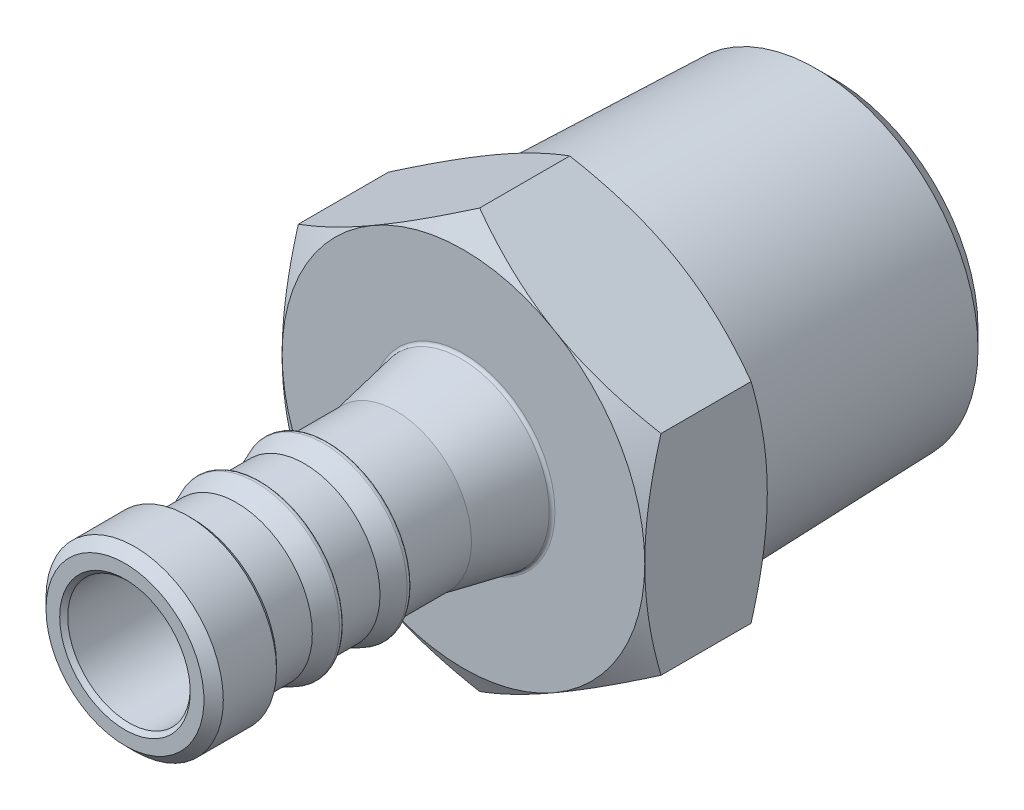
from build123d import *

# Parameters (mm, degrees)
CHAMFER1_SIZE       = 0.381
CHAMFER2_SIZE       = 0.762
SKETCH3_R           = 12.707475311
BOSS_EXTRUDE1_DEPTH = 19.558
BOSS_EXTRUDE1_DRAFT = -1.78333333
SKETCH6_OUTSIDE_W   = 81.226
SKETCH6_OUTSIDE_H   = 81.226
SKETCH6_OUTSIDE_R   = 11.332659983
CUT_EXTRUDE1_DEPTH  = 19.558
CUT_EXTRUDE1_DRAFT  = -45
BOSS_EXTRUDE2_DEPTH = 9.652
SKETCH8_OUTSIDE_W   = 78.192
SKETCH8_OUTSIDE_H   = 82.612
SKETCH8_OUTSIDE_R   = 14.2875
CUT_EXTRUDE2_DEPTH  = 9.652
CUT_EXTRUDE2_DRAFT  = -60
SKETCH9_OUTSIDE_W   = 78.192
SKETCH9_OUTSIDE_H   = 82.612
SKETCH9_OUTSIDE_R   = 14.2875
CUT_EXTRUDE3_DEPTH  = 9.652
CUT_EXTRUDE3_DRAFT  = -60
SKETCH10_W          = 36.322
SKETCH10_H          = 4.826
CHAMFER3_SIZE       = 0.3175
CHAMFER4_SIZE       = 0.508


with BuildPart() as part:
    # Sketch2 → Revolve1 (revolve)
    with BuildSketch(Plane(origin=(0, 0, 0), x_dir=(0, 0, -1), z_dir=(1, 0, 0)), mode=Mode.PRIVATE) as revolve1_sk:
        with BuildLine():
            Line((-21.082, 5.969), (-17.87705275, 5.969))
            Line((-17.87705275, 5.969), (-16.351150075, 6.585504699))
            ThreePointArc((-16.351150075, 6.585504699), (-16.113965003, 6.560575543), (-16.002, 6.35))
            Line((-16.002, 6.35), (-16.002, 6.223))
            ThreePointArc((-16.002, 6.223), (-15.927605122, 6.043394878), (-15.748, 5.969))
            Line((-15.748, 5.969), (-12.54305275, 5.969))
            Line((-12.54305275, 5.969), (-11.017150075, 6.585504699))
            ThreePointArc((-11.017150075, 6.585504699), (-10.779965003, 6.560575543), (-10.668, 6.35))
            Line((-10.668, 6.35), (-10.668, 6.223))
            ThreePointArc((-10.668, 6.223), (-10.593605122, 6.043394878), (-10.414, 5.969))
            Line((-10.414, 5.969), (-5.334, 5.969))
            Line((-5.334, 5.969), (-0.205534515, 6.965872706))
            ThreePointArc((-0.205534515, 6.965872706), (-0.058007356, 7.053642143), (0, 7.215206011))
            Line((0, 7.215206011), (0, 0))
            Line((0, 0), (-26.67, 0))
            Line((-26.67, 0), (-26.67, 6.985))
            Line((-26.67, 6.985), (-21.336, 6.985))
            Line((-21.336, 6.985), (-21.336, 6.223))
            ThreePointArc((-21.336, 6.223), (-21.261605122, 6.043394878), (-21.082, 5.969))
        make_face()
    revolve(revolve1_sk.sketch.rotate(Axis((0, 0, 26.67), (0, 0, -1)), 90), axis=Axis((0, 0, 26.67), (0, 0, -1)))

    # Chamfer1
    chamfer1_edges = [part.edges().sort_by_distance(p)[0] for p in [
        (-6.985, 0, 21.336),
    ]]
    chamfer(chamfer1_edges, length=CHAMFER1_SIZE)

    # Chamfer2
    chamfer2_edges = [part.edges().sort_by_distance(p)[0] for p in [
        (-6.985, 0, 26.67),
    ]]
    chamfer(chamfer2_edges, length=CHAMFER2_SIZE)



with BuildPart() as body_2:
    # Sketch3 → Boss-Extrude1 (with draft: the straight prism first)
    with BuildSketch(Plane.XY.offset(-29.21)):
        Circle(SKETCH3_R)
    extrude(amount=BOSS_EXTRUDE1_DEPTH)
    # Boss-Extrude1: the draft: its side faces are tilted about the plane it starts from
    boss_extrude1_sides = [body_2.faces().sort_by_distance(p)[0] for p in [
        (-12.707475311, 0, -19.431),
    ]]
    draft(boss_extrude1_sides, Plane.XY.offset(-29.21), BOSS_EXTRUDE1_DRAFT)


with BuildPart() as cut_extrude1_tool:
    # Sketch6 outside → Cut-Extrude1 (with draft: the straight prism first)
    with BuildSketch(Plane(origin=(0, 0, -29.21), x_dir=(-1, 0, 0), z_dir=(0, 0, -1))):
        Rectangle(SKETCH6_OUTSIDE_W, SKETCH6_OUTSIDE_H)
        Circle(SKETCH6_OUTSIDE_R, mode=Mode.SUBTRACT)
    extrude(amount=-CUT_EXTRUDE1_DEPTH)
    # Cut-Extrude1: the draft: its side faces are tilted about the plane it starts from
    cut_extrude1_sides = [cut_extrude1_tool.faces().sort_by_distance(p)[0] for p in [
        (0, -40.613, -19.431),
        (-40.613, 0, -19.431),
        (0, 40.613, -19.431),
        (40.613, 0, -19.431),
        (11.332659983, 0, -19.431),
    ]]
    draft(cut_extrude1_sides, Plane(origin=(0, 0, -29.21), x_dir=(-1, 0, 0), z_dir=(0, 0, -1)), CUT_EXTRUDE1_DRAFT)


with BuildPart() as body_2_1:
    add(body_2.part)

    # Cut-Extrude1: cut by cut_extrude1_tool
    add(cut_extrude1_tool.part, mode=Mode.SUBTRACT)


with BuildPart() as part_1:
    add(part.part)

    add(body_2_1.part)  # Boss-Extrude2 merges body 2
    # Sketch7 → Boss-Extrude2 (add)
    with BuildSketch(Plane(origin=(0, 0, 0), x_dir=(-1, 0, 0), z_dir=(0, 0, -1))):
        Polygon((0, 16.497783942), (-14.2875, 8.248891971), (-14.2875, -8.248891971), (0, -16.497783942), (14.2875, -8.248891971), (14.2875, 8.248891971), align=None)
    extrude(amount=BOSS_EXTRUDE2_DEPTH)


with BuildPart() as cut_extrude2_tool:
    # Sketch8 outside → Cut-Extrude2 (with draft: the straight prism first)
    with BuildSketch(Plane.XY):
        Rectangle(SKETCH8_OUTSIDE_W, SKETCH8_OUTSIDE_H)
        Circle(SKETCH8_OUTSIDE_R, mode=Mode.SUBTRACT)
    extrude(amount=-CUT_EXTRUDE2_DEPTH)
    # Cut-Extrude2: the draft: its side faces are tilted about the plane it starts from
    cut_extrude2_sides = [cut_extrude2_tool.faces().sort_by_distance(p)[0] for p in [
        (0, -41.306, -4.826),
        (39.096, 0, -4.826),
        (0, 41.306, -4.826),
        (-39.096, 0, -4.826),
        (-14.2875, 0, -4.826),
    ]]
    draft(cut_extrude2_sides, Plane.XY, CUT_EXTRUDE2_DRAFT)


with BuildPart() as part_2:
    add(part_1.part)

    # Cut-Extrude2: cut by cut_extrude2_tool
    add(cut_extrude2_tool.part, mode=Mode.SUBTRACT)


with BuildPart() as cut_extrude3_tool:
    # Sketch9 outside → Cut-Extrude3 (with draft: the straight prism first)
    with BuildSketch(Plane(origin=(0, 0, -9.652), x_dir=(-1, 0, 0), z_dir=(0, 0, -1))):
        Rectangle(SKETCH9_OUTSIDE_W, SKETCH9_OUTSIDE_H)
        Circle(SKETCH9_OUTSIDE_R, mode=Mode.SUBTRACT)
    extrude(amount=-CUT_EXTRUDE3_DEPTH)
    # Cut-Extrude3: the draft: its side faces are tilted about the plane it starts from
    cut_extrude3_sides = [cut_extrude3_tool.faces().sort_by_distance(p)[0] for p in [
        (0, -41.306, -4.826),
        (-39.096, 0, -4.826),
        (0, 41.306, -4.826),
        (39.096, 0, -4.826),
        (14.2875, 0, -4.826),
    ]]
    draft(cut_extrude3_sides, Plane(origin=(0, 0, -9.652), x_dir=(-1, 0, 0), z_dir=(0, 0, -1)), CUT_EXTRUDE3_DRAFT)


with BuildPart() as part_3:
    add(part_2.part)

    # Cut-Extrude3: cut by cut_extrude3_tool
    add(cut_extrude3_tool.part, mode=Mode.SUBTRACT)

    # Sketch10 → Cut-Revolve1 (revolve, cut)
    with BuildSketch(Plane(origin=(0, 0, 0), x_dir=(0, 0, -1), z_dir=(1, 0, 0)), mode=Mode.PRIVATE) as cut_revolve1_sk:
        with Locations((-8.509, 2.413)):
            Rectangle(SKETCH10_W, SKETCH10_H)
    revolve(cut_revolve1_sk.sketch.rotate(Axis((0, 0, 0), (0, 0, 1)), 90), axis=Axis((0, 0, 0), (0, 0, 1)), mode=Mode.SUBTRACT)

    # Chamfer3
    chamfer3_edges = [part_3.edges().sort_by_distance(p)[0] for p in [
        (4.826, 0, 26.67),
    ]]
    chamfer(chamfer3_edges, length=CHAMFER3_SIZE)

    # Sketch11 → Cut-Revolve2 (revolve, cut)
    with BuildSketch(Plane(origin=(0, 0, 0), x_dir=(0, 0, -1), z_dir=(1, 0, 0)), mode=Mode.PRIVATE) as cut_revolve2_sk:
        Polygon((29.21, 0), (29.21, 6.4135), (9.652, 6.4135), (5.79838042, 0), align=None)
    revolve(cut_revolve2_sk.sketch.rotate(Axis((0, 0, 0), (0, 0, -1)), 270), axis=Axis((0, 0, 0), (0, 0, -1)), mode=Mode.SUBTRACT)

    # Chamfer4
    chamfer4_edges = [part_3.edges().sort_by_distance(p)[0] for p in [
        (6.4135, 0, -29.21),
    ]]
    chamfer(chamfer4_edges, length=CHAMFER4_SIZE)


solid = part_3.part
